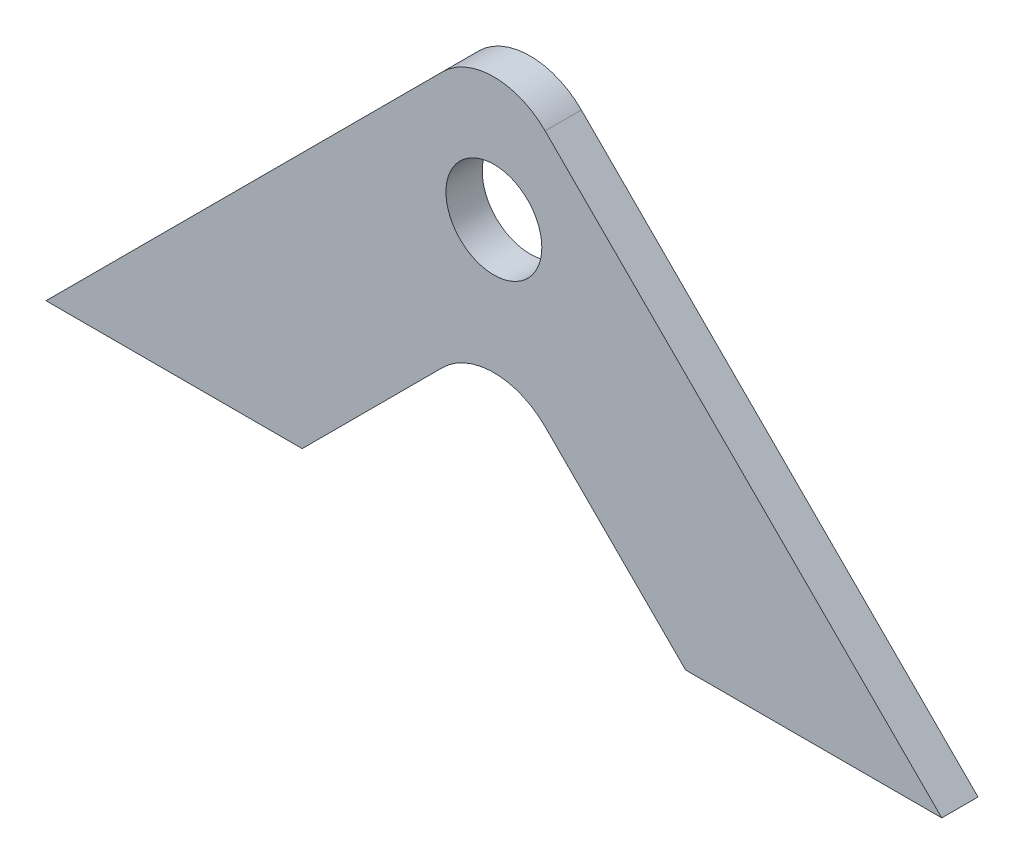
from build123d import *

# Parameters (mm, degrees)
SKETCH1_R           = 4.19989
BOSS_EXTRUDE2_DEPTH = 3.175


with BuildPart() as part:
    # Sketch1 → Boss-Extrude2 (new body)
    with BuildSketch(Plane.XY):
        with BuildLine():
            Line((33.609915001, 47.079525356), (-1.151277082, 12.319))
            Line((-1.151277082, 12.319), (21.29957853, 12.319))
            Line((21.29957853, 12.319), (33.609915001, 24.629100356))
            ThreePointArc((33.609915001, 24.629100356), (38.1, 26.488929235), (42.590084999, 24.629100356))
            Line((42.590084999, 24.629100356), (54.90042147, 12.319))
            Line((54.90042147, 12.319), (77.351277082, 12.319))
            Line((77.351277082, 12.319), (42.590084999, 47.079525356))
            ThreePointArc((42.590084999, 47.079525356), (38.1, 48.939354235), (33.609915001, 47.079525356))
        make_face()
        with Locations((38.1, 38.099269235)):
            Circle(SKETCH1_R, mode=Mode.SUBTRACT)
    extrude(amount=BOSS_EXTRUDE2_DEPTH)


solid = part.part
